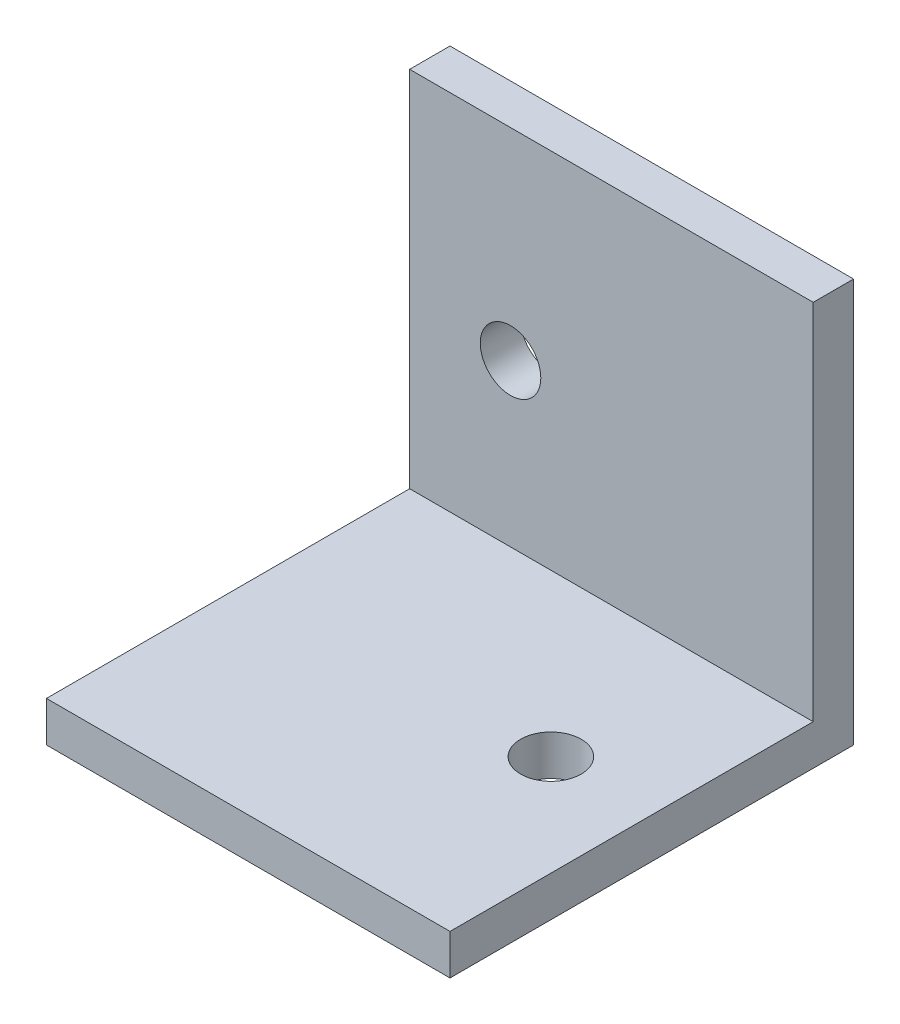
from build123d import *

# Parameters (mm, degrees)
SKETCH_1_W          = 20
SKETCH_1_H          = 20
EXTRUDE_1_DEPTH     = 2
SKETCH_2_W          = 20
SKETCH_2_H          = 2
EXTRUDE_2_DEPTH     = 18
SKETCH_3_R          = 1.5
CUT_EXTRUDE_1_DEPTH = 10
SKETCH_4_R          = 1.5
CUT_EXTRUDE_2_DEPTH = 10


with BuildPart() as part:
    # 草图1 → 凸台-拉伸1 (new body)
    with BuildSketch(Plane.XY):
        Rectangle(SKETCH_1_W, SKETCH_1_H)
    extrude(amount=EXTRUDE_1_DEPTH)

    # 草图2 → 凸台-拉伸2 (add)
    with BuildSketch(Plane.XY.offset(2)):
        with Locations((0, -9)):
            Rectangle(SKETCH_2_W, SKETCH_2_H)
    extrude(amount=EXTRUDE_2_DEPTH)

    # 草图3 → 切除-拉伸1 (cut)
    with BuildSketch(Plane.XY.offset(2)):
        with Locations((-5, 0)):
            Circle(SKETCH_3_R)
    extrude(amount=-CUT_EXTRUDE_1_DEPTH, mode=Mode.SUBTRACT)

    # 草图4 → 切除-拉伸2 (cut)
    with BuildSketch(Plane(origin=(0, -8, 0), x_dir=(1, 0, 0), z_dir=(0, 1, 0))):
        with Locations(Location((5, -10, 0), (0, 0, 270))):
            Circle(SKETCH_4_R)
    extrude(amount=-CUT_EXTRUDE_2_DEPTH, mode=Mode.SUBTRACT)


solid = part.part
